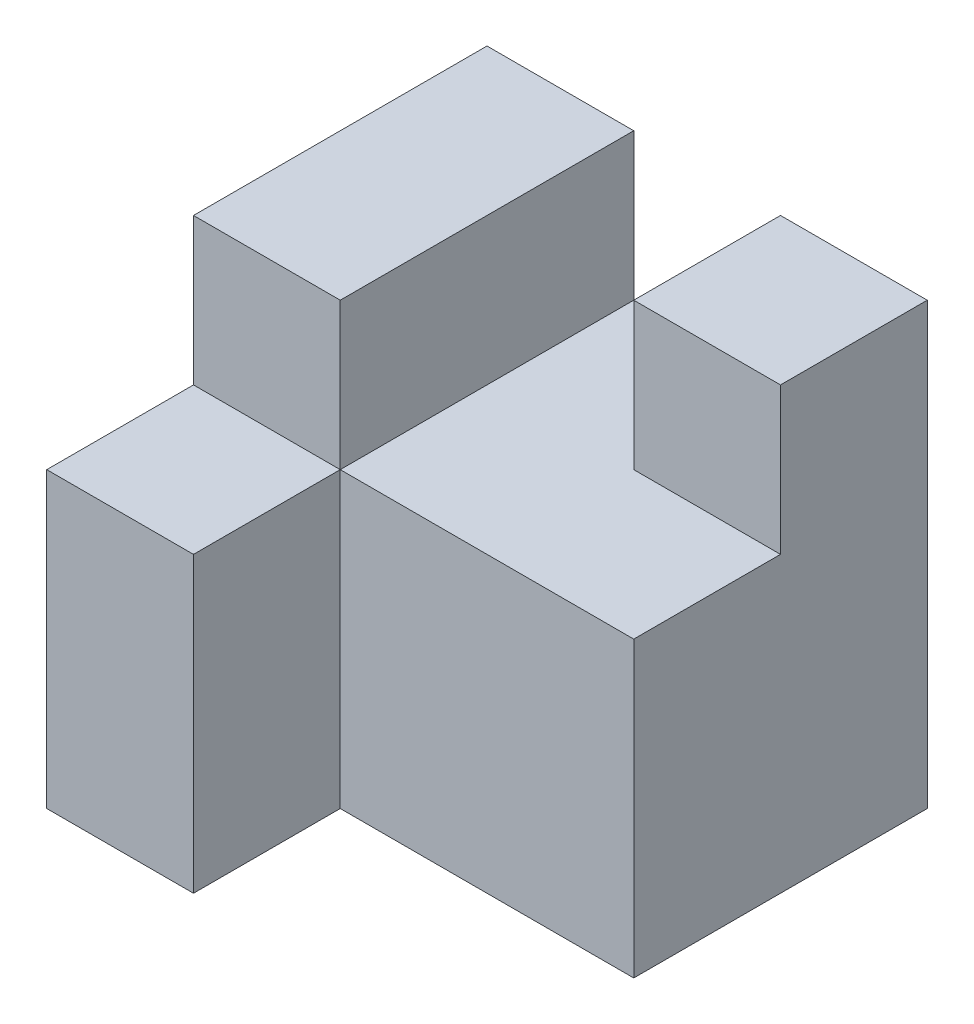
from build123d import *

# Parameters (mm, degrees)
SKETCH_1_W          = 30
SKETCH_1_H          = 30
EXTRUDE_1_DEPTH     = 30
SKETCH_5_W          = 10
SKETCH_5_H          = 10
CUT_EXTRUDE_4_DEPTH = 52.961524227
SKETCH_7_W          = 20
SKETCH_7_H          = 10
CUT_EXTRUDE_5_DEPTH = 52.961524227
SKETCH_9_W          = 10
SKETCH_9_H          = 10
CUT_EXTRUDE_6_DEPTH = 52.961524227
SKETCH_10_W         = 10
SKETCH_10_H         = 10
CUT_EXTRUDE_7_DEPTH = 15


with BuildPart() as part:
    # 草圖1 → 填料-伸1 (new body)
    with BuildSketch(Plane.XY):
        with Locations((15, 15)):
            Rectangle(SKETCH_1_W, SKETCH_1_H)
    extrude(amount=-EXTRUDE_1_DEPTH)

    # 草圖5 → 除料-伸長4 (cut, through all)
    with BuildSketch(Plane.XY):
        with Locations((15, 25)):
            Rectangle(SKETCH_5_W, SKETCH_5_H)
    extrude(amount=-CUT_EXTRUDE_4_DEPTH, mode=Mode.SUBTRACT)

    # 草圖7 → 除料-伸長5 (cut, through all)
    with BuildSketch(Plane(origin=(0, 30, 0), x_dir=(1, 0, 0), z_dir=(0, 1, 0))):
        with Locations((20, 5)):
            Rectangle(SKETCH_7_W, SKETCH_7_H)
    extrude(amount=-CUT_EXTRUDE_5_DEPTH, mode=Mode.SUBTRACT)

    # 草圖9 → 除料-伸長6 (cut, through all)
    with BuildSketch(Plane(origin=(30, 0, 0), x_dir=(0, 0, -1), z_dir=(1, 0, 0))):
        with Locations((5, 25)):
            Rectangle(SKETCH_9_W, SKETCH_9_H)
    extrude(amount=-CUT_EXTRUDE_6_DEPTH, mode=Mode.SUBTRACT)

    # 草圖10 → 除料-伸長7 (cut)
    with BuildSketch(Plane(origin=(30, 0, 0), x_dir=(0, 0, -1), z_dir=(1, 0, 0))):
        with Locations((15, 25)):
            Rectangle(SKETCH_10_W, SKETCH_10_H)
    extrude(amount=-CUT_EXTRUDE_7_DEPTH, mode=Mode.SUBTRACT)


solid = part.part
